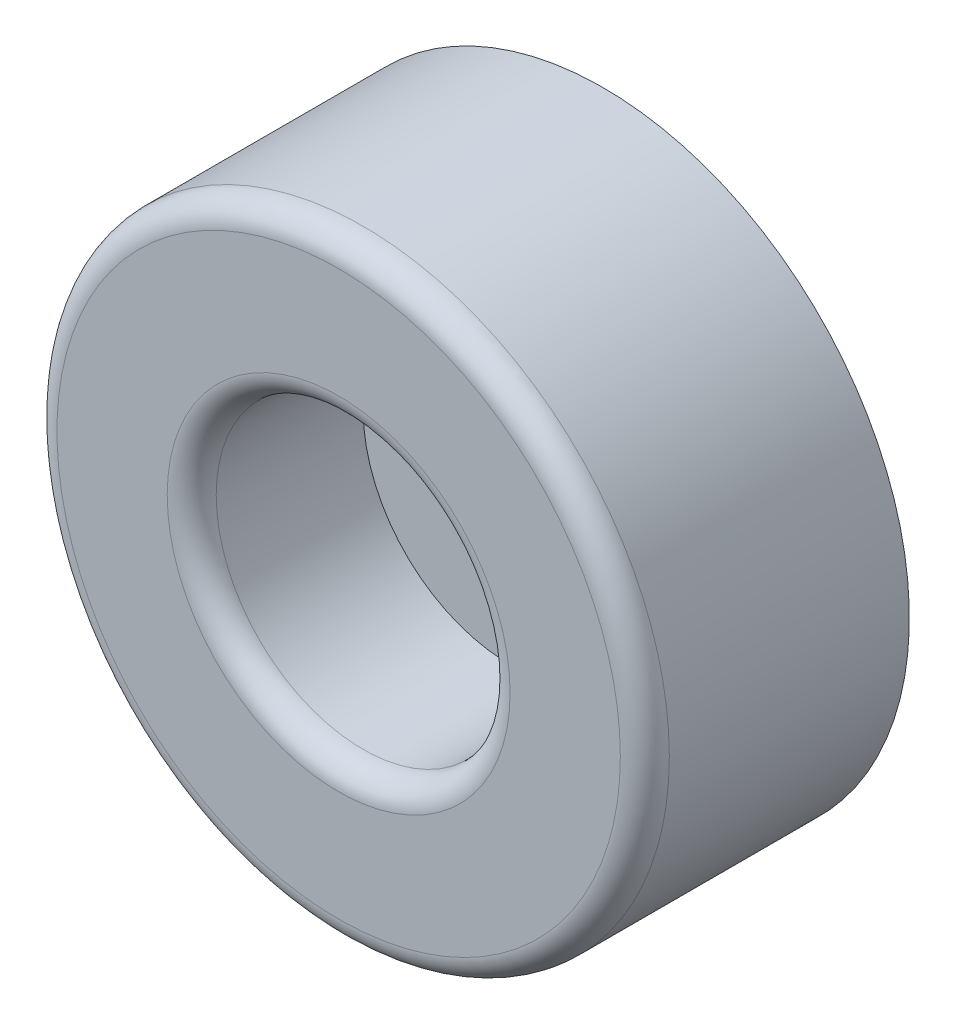
from build123d import *

# Parameters (mm, degrees)
SKIZZE1_R                            = 12.5
AUFSATZ_LINEAR_AUSTRAGEN1_DEPTH      = 10.8
SKIZZE2_R                            = 6
SCHNITT_LINEAR_AUSTRAGEN1_DEPTH      = 7
SCHNITT_LINEAR_AUSTRAGEN2_DEPTH      = 20.013153342
SCHNITT_LINEAR_AUSTRAGEN2_DEPTH_BACK = 20.013153342
SKIZZE3_R                            = 2.5
VERRUNDUNG1_R                        = 1


with BuildPart() as part:
    # Skizze1 → Aufsatz-Linear austragen1 (new body)
    with BuildSketch(Plane(origin=(0, 0, 0), x_dir=(0, 1, 0), z_dir=(0, 0, 1))):
        with Locations(Location((0, 0, 0), (0, 0, 90))):
            Circle(SKIZZE1_R)
    extrude(amount=AUFSATZ_LINEAR_AUSTRAGEN1_DEPTH)

    # Skizze2 → Schnitt-Linear austragen1 (cut)
    with BuildSketch(Plane.XY.offset(10.8)):
        Circle(SKIZZE2_R)
    extrude(amount=-SCHNITT_LINEAR_AUSTRAGEN1_DEPTH, mode=Mode.SUBTRACT)

    # Skizze3 → Schnitt-Linear austragen2 (cut, two sides: drawn at the far end of the back side and taken through both)
    with BuildSketch(Plane.XY.offset(3.8).offset(-SCHNITT_LINEAR_AUSTRAGEN2_DEPTH_BACK)):
        Circle(SKIZZE3_R)
    extrude(amount=SCHNITT_LINEAR_AUSTRAGEN2_DEPTH + SCHNITT_LINEAR_AUSTRAGEN2_DEPTH_BACK, mode=Mode.SUBTRACT)

    # Verrundung1
    verrundung1_edges = [part.edges().sort_by_distance(p)[0] for p in [
        (12.5, 0, 10.8),
        (-6, 0, 10.8),
    ]]
    fillet(verrundung1_edges, radius=VERRUNDUNG1_R)


solid = part.part
